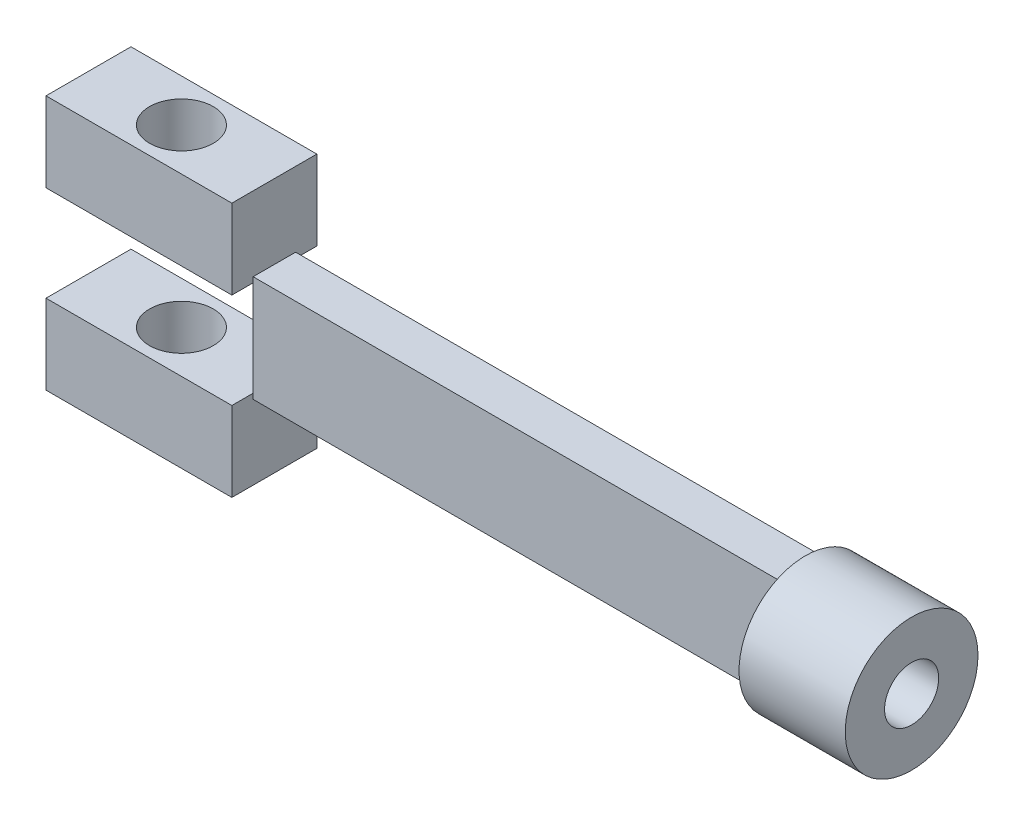
from build123d import *

# Parameters (mm, degrees)
ESQUISSE1_W                  = 100
ESQUISSE1_H                  = 20
BOSS_EXTRU_1_DEPTH           = 4
BOSS_EXTRU_2_DEPTH           = 4
BOSS_EXTRU_2_DEPTH_BACK      = 12
ESQUISSE2_W                  = 35
ESQUISSE2_H                  = 48
ENL_V_MAT_EXTRU_1_DEPTH      = 90.134729483
ENL_V_MAT_EXTRU_1_DEPTH_BACK = 90.134729483
ESQUISSE3_W                  = 35
ESQUISSE3_H                  = 18
ENL_V_MAT_EXTRU_2_DEPTH      = 98.943861472
ENL_V_MAT_EXTRU_2_DEPTH_BACK = 98.943861472
ESQUISSE6_R                  = 6
ESQUISSE7_R                  = 12.5
BOSS_EXTRU_3_DEPTH           = 20
M12_TAPPED_HOLE1_D           = 10.2
M12_TAPPED_HOLE1_DEPTH       = 18
M12_TAPPED_HOLE1_TIP         = 3.064389157


with BuildPart() as part:
    # Esquisse1 → Boss.-Extru.1 (new, symmetric)
    with BuildSketch(Plane.XY):
        Rectangle(ESQUISSE1_W, ESQUISSE1_H)
    extrude(amount=BOSS_EXTRU_1_DEPTH, both=True)

    # Esquisse2 → Boss.-Extru.2 (add, two sides: drawn at the far end of the back side and taken through both)
    with BuildSketch(Plane.XY.offset(4).offset(-BOSS_EXTRU_2_DEPTH_BACK)):
        with Locations((-67.5, 0)):
            Rectangle(ESQUISSE2_W, ESQUISSE2_H)
    extrude(amount=BOSS_EXTRU_2_DEPTH + BOSS_EXTRU_2_DEPTH_BACK)

    # Esquisse3 → Enlèv. mat.-Extru.1 (cut, two sides: drawn at the far end of the back side and taken through both)
    with BuildSketch(Plane.XY.offset(4).offset(-ENL_V_MAT_EXTRU_1_DEPTH_BACK)):
        with Locations((-67.5, 0)):
            Rectangle(ESQUISSE3_W, ESQUISSE3_H)
    extrude(amount=ENL_V_MAT_EXTRU_1_DEPTH + ENL_V_MAT_EXTRU_1_DEPTH_BACK, mode=Mode.SUBTRACT)

    # Esquisse6 → Enlèv. mat.-Extru.2 (cut, two sides: drawn at the far end of the back side and taken through both)
    with BuildSketch(Plane(origin=(0, 24, 0), x_dir=(1, 0, 0), z_dir=(0, 1, 0)).offset(-ENL_V_MAT_EXTRU_2_DEPTH_BACK)):
        with Locations((-67.5, 0)):
            Circle(ESQUISSE6_R)
    extrude(amount=ENL_V_MAT_EXTRU_2_DEPTH + ENL_V_MAT_EXTRU_2_DEPTH_BACK, mode=Mode.SUBTRACT)

    # Esquisse7 → Boss.-Extru.3 (add)
    with BuildSketch(Plane(origin=(50, 0, 0), x_dir=(0, 0, -1), z_dir=(1, 0, 0))):
        Circle(ESQUISSE7_R)
    extrude(amount=BOSS_EXTRU_3_DEPTH)

    # M12 Tapped Hole1
    with Locations(Plane(origin=(70, 0, 0), x_dir=(0, 0, -1), z_dir=(1, 0, 0))):
        with Locations((0, 0)):
            Hole(M12_TAPPED_HOLE1_D / 2, depth=M12_TAPPED_HOLE1_DEPTH)
            with Locations((0, 0, -(M12_TAPPED_HOLE1_DEPTH + M12_TAPPED_HOLE1_TIP / 2))):  # 118° drill point
                Cone(0, M12_TAPPED_HOLE1_D / 2, M12_TAPPED_HOLE1_TIP, mode=Mode.SUBTRACT)


solid = part.part
